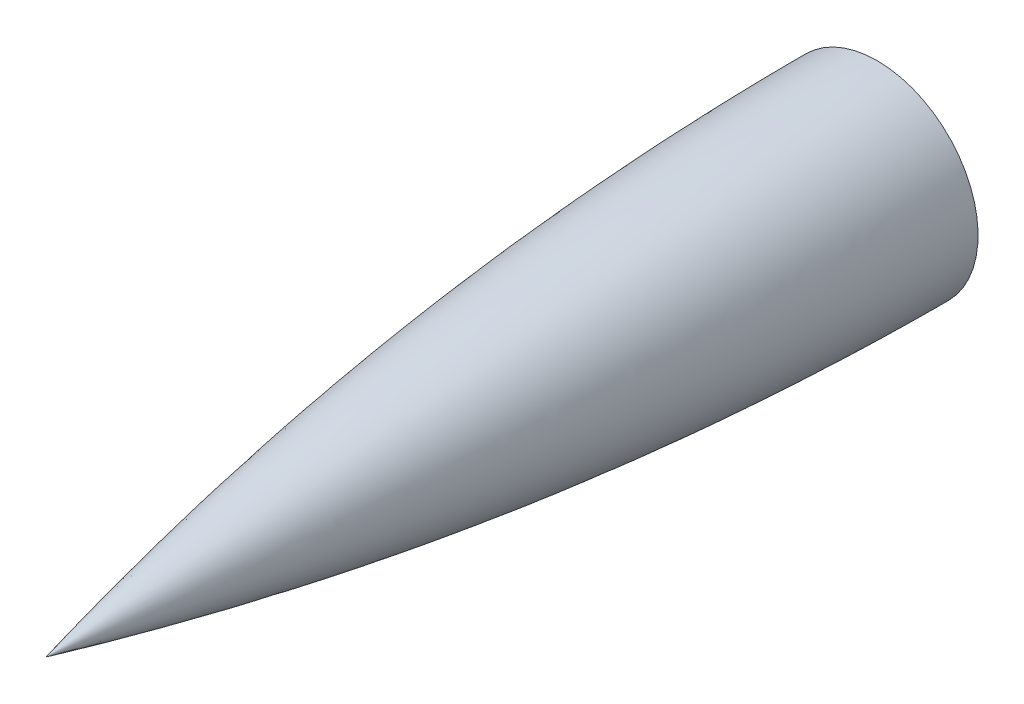
from build123d import *


with BuildPart() as part:
    # Sketch1 → Revolve1 (revolve)
    with BuildSketch(Plane(origin=(0, 0, 0), x_dir=(0, 0, -1), z_dir=(1, 0, 0))):
        with BuildLine():
            Line((0, 50.8), (0, 0))
            Line((0, 0), (-419.099999998, 0))
            add(Edge.make_bspline(
                [(-419.099999998, 0), (-209.549999998, 50.8), (0, 50.8)],
                knots=[0.081779905, 0.081779905, 0.081779905, 0.916525446, 0.916525446, 0.916525446], degree=2))
        make_face()
    revolve(axis=Axis((0, 0, 0), (0, 0, 1)))


solid = part.part
